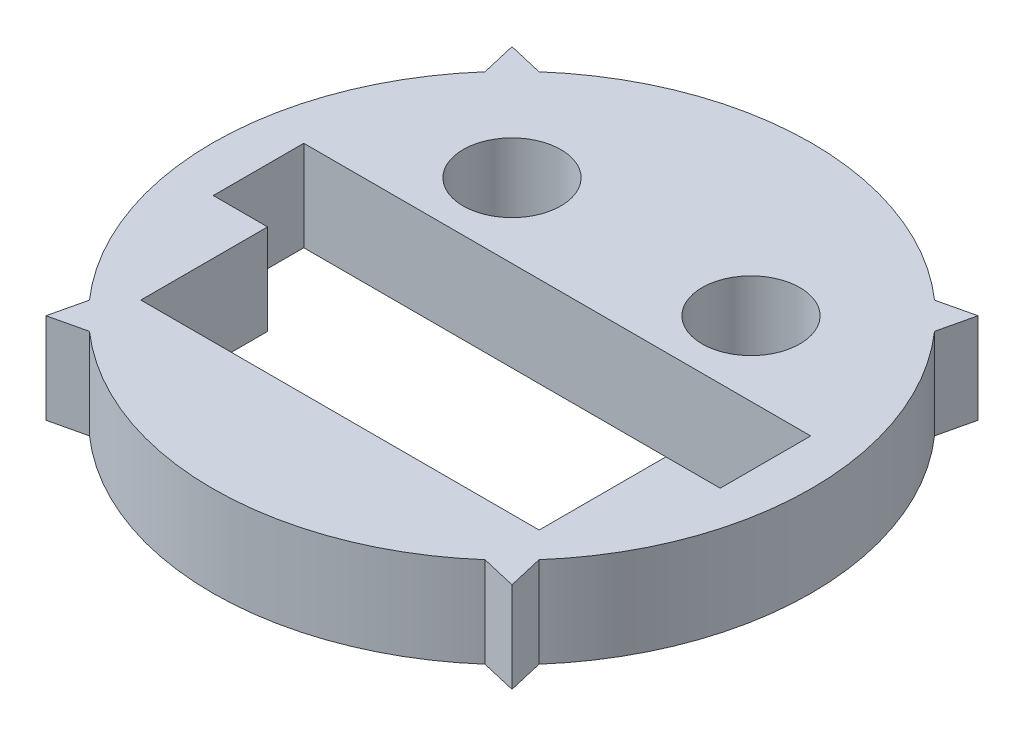
from build123d import *

# Parameters (mm, degrees)
SKETCH1_R           = 3.429
BOSS_EXTRUDE1_DEPTH = 6.35


with BuildPart() as part:
    # Sketch1 → Boss-Extrude1 (new body)
    with BuildSketch(Plane(origin=(0, 0, 0), x_dir=(1, 0, 0), z_dir=(0, 1, 0))):
        with BuildLine():
            Line((13.870085237, 15.767711804), (16.343875029, 16.343875029))
            Line((16.343875029, 16.343875029), (15.767711804, 13.870085237))
            ThreePointArc((15.767711804, 13.870085237), (21, 0), (15.767711804, -13.870085237))
            Line((15.767711804, -13.870085237), (16.343875029, -16.343875029))
            Line((16.343875029, -16.343875029), (13.870085237, -15.767711804))
            ThreePointArc((13.870085237, -15.767711804), (0, -21), (-13.870085237, -15.767711804))
            Line((-13.870085237, -15.767711804), (-16.343875029, -16.343875029))
            Line((-16.343875029, -16.343875029), (-15.767711804, -13.870085237))
            ThreePointArc((-15.767711804, -13.870085237), (-21, 0), (-15.767711804, 13.870085237))
            Line((-15.767711804, 13.870085237), (-16.343875029, 16.343875029))
            Line((-16.343875029, 16.343875029), (-13.870085237, 15.767711804))
            ThreePointArc((-13.870085237, 15.767711804), (0, 21), (13.870085237, 15.767711804))
        make_face()
        with Locations(Location((-8.382, 8.382, 0), (0, 0, 270))):
            Circle(SKETCH1_R, mode=Mode.SUBTRACT)
        with Locations(Location((8.382, 8.382, 0), (0, 0, 270))):
            Circle(SKETCH1_R, mode=Mode.SUBTRACT)
        Polygon((-13.97, -3.175), (-13.97, -12.065), (13.97, -12.065), (13.97, -3.175), (17.78, -3.175), (17.78, 3.175), (-17.78, 3.175), (-17.78, -3.175), align=None, mode=Mode.SUBTRACT)
    extrude(amount=BOSS_EXTRUDE1_DEPTH)


solid = part.part
